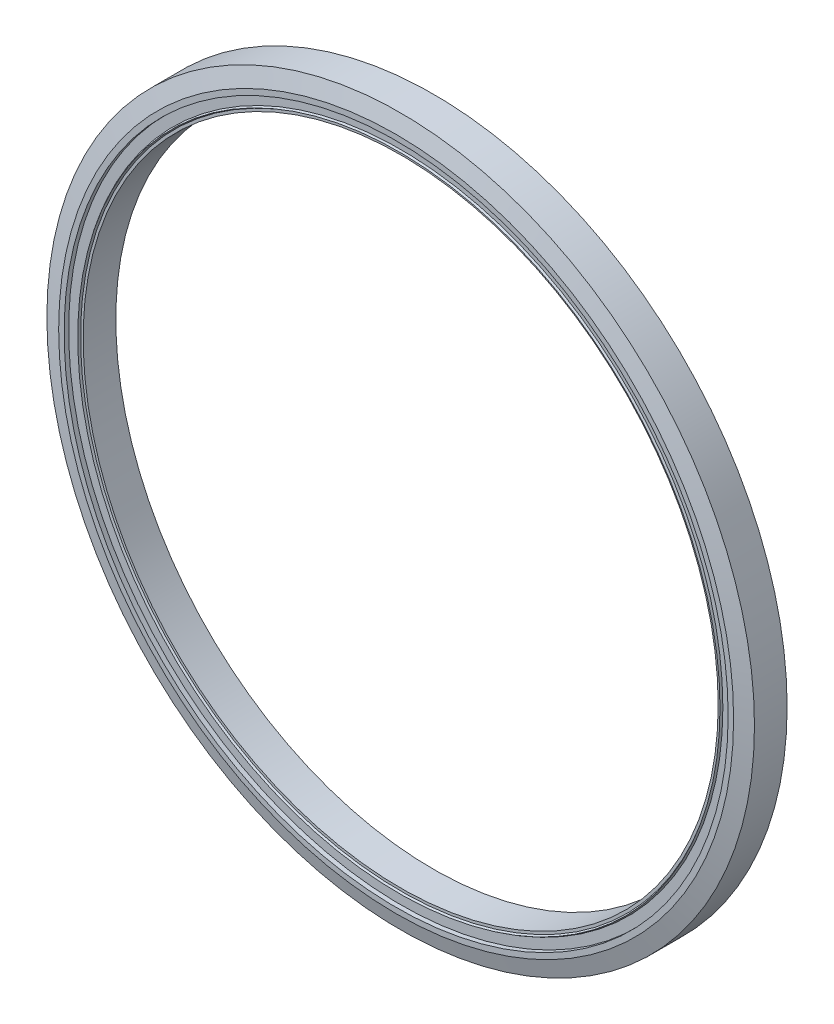
from build123d import *


with BuildPart() as part:
    # Sketch2 → Revolve2 (revolve)
    with BuildSketch(Plane(origin=(0, 0, 0), x_dir=(0, 0, -1), z_dir=(1, 0, 0))):
        Polygon((-0.9, 19.5), (0.9, 19.5), (1.15, 18.6), (1.15, 18.3), (0.9, 18.3), (0.9, 17.757735027), (1, 17.7), (0.9, 17.642264973), (0.9, 17.5), (-0.9, 17.5), (-0.9, 17.642264973), (-1, 17.7), (-0.9, 17.757735027), (-0.9, 18.3), (-1.15, 18.3), (-1.15, 18.6), align=None)
    revolve(axis=Axis((0, 0, 0), (0, 0, -1)))


solid = part.part
